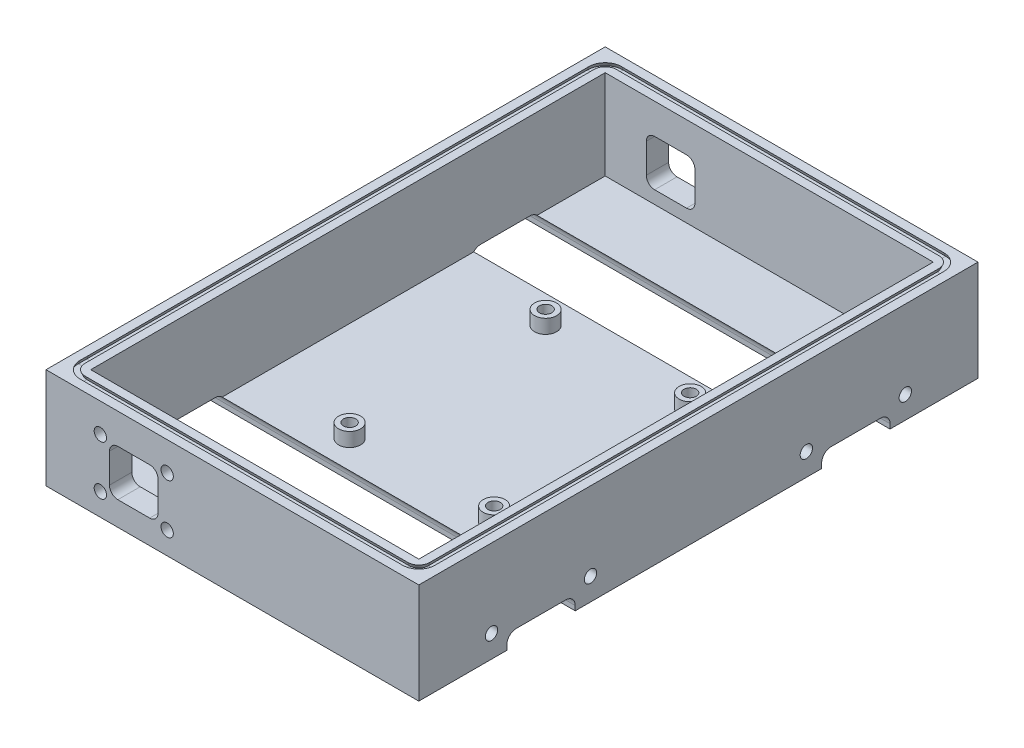
from build123d import *

# Parameters (mm, degrees)
SKETCH1_W           = 169.3418
SKETCH1_H           = 254
BOSS_EXTRUDE1_DEPTH = 45.72
SKETCH2_W           = 149.0218
SKETCH2_H           = 233.68
CUT_EXTRUDE1_DEPTH  = 40.64
CUT_EXTRUDE10_REACH = 310.679
F_12_PIN_MOUNT_R    = 2.7999944
CUT_EXTRUDE3_DEPTH  = 5.499989
CUT_EXTRUDE5_REACH  = 310.679
CUT_EXTRUDE6_START  = -254
CUT_EXTRUDE6_DEPTH  = 10.16
SKETCH6_R           = 2.7999944
CUT_EXTRUDE7_DEPTH  = 5.499989
CUT_EXTRUDE8_START  = -248.500011
SKETCH6_2_R         = 2.7999944
CUT_EXTRUDE8_DEPTH  = 5.499989
SKETCH7_R           = 5
BOSS_EXTRUDE2_DEPTH = 6.35
CUT_EXTRUDE9_START  = 6.35
SKETCH8_R           = 2.7999944
CUT_EXTRUDE9_DEPTH  = 5.499989


with BuildPart() as part:
    # Sketch1 → Boss-Extrude1 (new body)
    with BuildSketch(Plane(origin=(0, 0, 0), x_dir=(1, 0, 0), z_dir=(0, 1, 0))):
        with Locations((84.6709, 127)):
            Rectangle(SKETCH1_W, SKETCH1_H)
    extrude(amount=BOSS_EXTRUDE1_DEPTH)

    # Sketch2 → Cut-Extrude1 (cut)
    with BuildSketch(Plane(origin=(0, 45.72, 0), x_dir=(1, 0, 0), z_dir=(0, 1, 0))):
        with Locations((84.6709, 127)):
            Rectangle(SKETCH2_W, SKETCH2_H)
    extrude(amount=-CUT_EXTRUDE1_DEPTH, mode=Mode.SUBTRACT)

    # Cut-Sweep2: sweep along a path in Sketch3
    with BuildLine(Plane(origin=(0, 45.72, 0), x_dir=(1, 0, 0), z_dir=(0, 1, 0))) as cut_sweep2_path:
        Line((6.35, 11.43), (6.35, 242.57))
        ThreePointArc((6.35, 242.57), (7.837897552, 246.162102448), (11.43, 247.65))
        Line((11.43, 247.65), (157.9118, 247.65))
        ThreePointArc((157.9118, 247.65), (161.503902448, 246.162102448), (162.9918, 242.57))
        Line((162.9918, 242.57), (162.9918, 11.43))
        ThreePointArc((162.9918, 11.43), (161.503902448, 7.837897552), (157.9118, 6.35))
        Line((157.9118, 6.35), (11.43, 6.35))
        ThreePointArc((11.43, 6.35), (7.837897552, 7.837897552), (6.35, 11.43))
    # Sketch4 → Cut-Sweep2 (sweep, cut)
    with BuildSketch(Plane.XY.offset(-15.24)):
        Polygon((4.064, 45.72), (3.272383398, 43.942), (7.141616602, 43.942), (6.35, 45.72), align=None)
    sweep(path=cut_sweep2_path.line, mode=Mode.SUBTRACT)

    # Sketch13 → Cut-Extrude10 (cut, up to next)
    with BuildSketch(Plane(origin=(169.3418, 0, 0), x_dir=(0, 0, -1), z_dir=(1, 0, 0)), mode=Mode.PRIVATE) as cut_extrude10_sk1:
        with BuildLine():
            Line((48.5902, -10.7823), (48.5902, -12.4587))
            ThreePointArc((48.5902, -12.4587), (48.813384633, -12.997515367), (49.3522, -13.2207))
            Line((49.3522, -13.2207), (61.6458, -13.2207))
            ThreePointArc((61.6458, -13.2207), (62.184615367, -12.997515367), (62.4078, -12.4587))
            Line((62.4078, -12.4587), (62.4078, -10.7823))
            ThreePointArc((62.4078, -10.7823), (62.630984633, -10.243484633), (63.1698, -10.0203))
            Line((63.1698, -10.0203), (66.7004, -10.0203))
            ThreePointArc((66.7004, -10.0203), (69.771647593, -8.748147593), (71.0438, -5.6769))
            Line((71.0438, -5.6769), (71.0438, 2.1209))
            ThreePointArc((71.0438, 2.1209), (69.771647593, 5.192147593), (66.7004, 6.4643))
            Line((66.7004, 6.4643), (44.2976, 6.4643))
            ThreePointArc((44.2976, 6.4643), (41.226352407, 5.192147593), (39.9542, 2.1209))
            Line((39.9542, 2.1209), (39.9542, -5.6769))
            ThreePointArc((39.9542, -5.6769), (41.226352407, -8.748147593), (44.2976, -10.0203))
            Line((44.2976, -10.0203), (47.8282, -10.0203))
            ThreePointArc((47.8282, -10.0203), (48.367015367, -10.243484633), (48.5902, -10.7823))
        make_face()
    cut_extrude10_tool1 = extrude(cut_extrude10_sk1.sketch, amount=-CUT_EXTRUDE10_REACH, mode=Mode.PRIVATE) & part.part
    # Sketch13 → Cut-Extrude10 (cut, up to next)
    with BuildSketch(Plane(origin=(169.3418, 0, 0), x_dir=(0, 0, -1), z_dir=(1, 0, 0)), mode=Mode.PRIVATE) as cut_extrude10_sk2:
        with BuildLine():
            Line((191.5922, -10.7823), (191.5922, -12.4587))
            ThreePointArc((191.5922, -12.4587), (191.815384633, -12.997515367), (192.3542, -13.2207))
            Line((192.3542, -13.2207), (204.6478, -13.2207))
            ThreePointArc((204.6478, -13.2207), (205.186615367, -12.997515367), (205.4098, -12.4587))
            Line((205.4098, -12.4587), (205.4098, -10.7823))
            ThreePointArc((205.4098, -10.7823), (205.632984633, -10.243484633), (206.1718, -10.0203))
            Line((206.1718, -10.0203), (209.7024, -10.0203))
            ThreePointArc((209.7024, -10.0203), (212.773647593, -8.748147593), (214.0458, -5.6769))
            Line((214.0458, -5.6769), (214.0458, 2.1209))
            ThreePointArc((214.0458, 2.1209), (212.773647593, 5.192147593), (209.7024, 6.4643))
            Line((209.7024, 6.4643), (187.2996, 6.4643))
            ThreePointArc((187.2996, 6.4643), (184.228352407, 5.192147593), (182.9562, 2.1209))
            Line((182.9562, 2.1209), (182.9562, -5.6769))
            ThreePointArc((182.9562, -5.6769), (184.228352407, -8.748147593), (187.2996, -10.0203))
            Line((187.2996, -10.0203), (190.8302, -10.0203))
            ThreePointArc((190.8302, -10.0203), (191.369015367, -10.243484633), (191.5922, -10.7823))
        make_face()
    cut_extrude10_tool2 = extrude(cut_extrude10_sk2.sketch, amount=-CUT_EXTRUDE10_REACH, mode=Mode.PRIVATE) & part.part
    add(cut_extrude10_tool1.solids().sort_by_distance((169.3418, -2.58192, -55.499))[0], mode=Mode.SUBTRACT)
    add(cut_extrude10_tool2.solids().sort_by_distance((169.3418, -2.58192, -198.501))[0], mode=Mode.SUBTRACT)

    # 12 pin mount → Cut-Extrude3 (cut)
    with BuildSketch(Plane(origin=(169.3418, 0, 0), x_dir=(0, 0, -1), z_dir=(1, 0, 0))):
        with Locations((77.978, -13.716)):
            Circle(F_12_PIN_MOUNT_R)
        with Locations((77.978, 10.16)):
            Circle(F_12_PIN_MOUNT_R)
        with Locations((33.02, 10.16)):
            Circle(F_12_PIN_MOUNT_R)
        with Locations((33.02, -13.716)):
            Circle(F_12_PIN_MOUNT_R)
        with Locations((176.022, -13.716)):
            Circle(F_12_PIN_MOUNT_R)
        with Locations((220.98, -13.716)):
            Circle(F_12_PIN_MOUNT_R)
        with Locations((220.98, 10.16)):
            Circle(F_12_PIN_MOUNT_R)
        with Locations((176.022, 10.16)):
            Circle(F_12_PIN_MOUNT_R)
    extrude(amount=-CUT_EXTRUDE3_DEPTH, mode=Mode.SUBTRACT)

    # 4 pin connector → Cut-Extrude5 (cut, up to next)
    with BuildSketch(Plane.XY, mode=Mode.PRIVATE) as cut_extrude5_sk1:
        with BuildLine():
            Line((32.6263, 31.877), (47.1043, 31.877))
            ThreePointArc((47.1043, 31.877), (49.798376836, 30.761076836), (50.9143, 28.067))
            Line((50.9143, 28.067), (50.9143, 14.7066))
            ThreePointArc((50.9143, 14.7066), (49.798376836, 12.012523164), (47.1043, 10.8966))
            Line((47.1043, 10.8966), (32.6263, 10.8966))
            ThreePointArc((32.6263, 10.8966), (29.932223164, 12.012523164), (28.8163, 14.7066))
            Line((28.8163, 14.7066), (28.8163, 28.067))
            ThreePointArc((28.8163, 28.067), (29.932223164, 30.761076836), (32.6263, 31.877))
        make_face()
    cut_extrude5_tool1 = extrude(cut_extrude5_sk1.sketch, amount=-CUT_EXTRUDE5_REACH, mode=Mode.PRIVATE) & part.part
    add(cut_extrude5_tool1.solids().sort_by_distance((39.8653, 21.3868, 0))[0], mode=Mode.SUBTRACT)

    # Sketch5<2> → Cut-Extrude6 (cut)
    with BuildSketch(Plane.XY.offset(CUT_EXTRUDE6_START)):
        with BuildLine():
            Line((32.6263, 31.877), (47.1043, 31.877))
            ThreePointArc((47.1043, 31.877), (49.798376836, 30.761076836), (50.9143, 28.067))
            Line((50.9143, 28.067), (50.9143, 14.7066))
            ThreePointArc((50.9143, 14.7066), (49.798376836, 12.012523164), (47.1043, 10.8966))
            Line((47.1043, 10.8966), (32.6263, 10.8966))
            ThreePointArc((32.6263, 10.8966), (29.932223164, 12.012523164), (28.8163, 14.7066))
            Line((28.8163, 14.7066), (28.8163, 28.067))
            ThreePointArc((28.8163, 28.067), (29.932223164, 30.761076836), (32.6263, 31.877))
        make_face()
    extrude(amount=CUT_EXTRUDE6_DEPTH, mode=Mode.SUBTRACT)

    # Sketch6 → Cut-Extrude7 (cut)
    with BuildSketch(Plane.XY):
        with Locations((55.0418, 32.6136)):
            Circle(SKETCH6_R)
        with Locations((55.0418, 10.16)):
            Circle(SKETCH6_R)
        with Locations((24.6888, 10.16)):
            Circle(SKETCH6_R)
        with Locations((24.6888, 32.6136)):
            Circle(SKETCH6_R)
    extrude(amount=-CUT_EXTRUDE7_DEPTH, mode=Mode.SUBTRACT)

    # Sketch6<2> → Cut-Extrude8 (cut)
    with BuildSketch(Plane.XY.offset(CUT_EXTRUDE8_START)):
        with Locations((55.0418, 32.6136)):
            Circle(SKETCH6_2_R)
        with Locations((55.0418, 10.16)):
            Circle(SKETCH6_2_R)
        with Locations((24.6888, 10.16)):
            Circle(SKETCH6_2_R)
        with Locations((24.6888, 32.6136)):
            Circle(SKETCH6_2_R)
    extrude(amount=-CUT_EXTRUDE8_DEPTH, mode=Mode.SUBTRACT)

    # Sketch7 → Boss-Extrude2 (add)
    with BuildSketch(Plane(origin=(0, 5.08, 0), x_dir=(1, 0, 0), z_dir=(0, 1, 0))):
        with Locations(Location((55.4218, 82.485, 0), (0, 0, 90))):
            Circle(SKETCH7_R)
        with Locations(Location((121.0818, 82.485, 0), (0, 0, 90))):
            Circle(SKETCH7_R)
        with Locations(Location((121.0818, 171.515, 0), (0, 0, 90))):
            Circle(SKETCH7_R)
        with Locations(Location((55.4218, 171.515, 0), (0, 0, 90))):
            Circle(SKETCH7_R)
    extrude(amount=BOSS_EXTRUDE2_DEPTH)

    # Sketch8 → Cut-Extrude9 (cut)
    with BuildSketch(Plane(origin=(0, 5.08, 0), x_dir=(1, 0, 0), z_dir=(0, 1, 0)).offset(CUT_EXTRUDE9_START)):
        with Locations(Location((55.4218, 171.515, 0), (0, 0, 270))):
            Circle(SKETCH8_R)
        with Locations(Location((121.0818, 171.515, 0), (0, 0, 270))):
            Circle(SKETCH8_R)
        with Locations(Location((121.0818, 82.485, 0), (0, 0, 270))):
            Circle(SKETCH8_R)
        with Locations(Location((55.4218, 82.485, 0), (0, 0, 270))):
            Circle(SKETCH8_R)
    extrude(amount=-CUT_EXTRUDE9_DEPTH, mode=Mode.SUBTRACT)


solid = part.part
